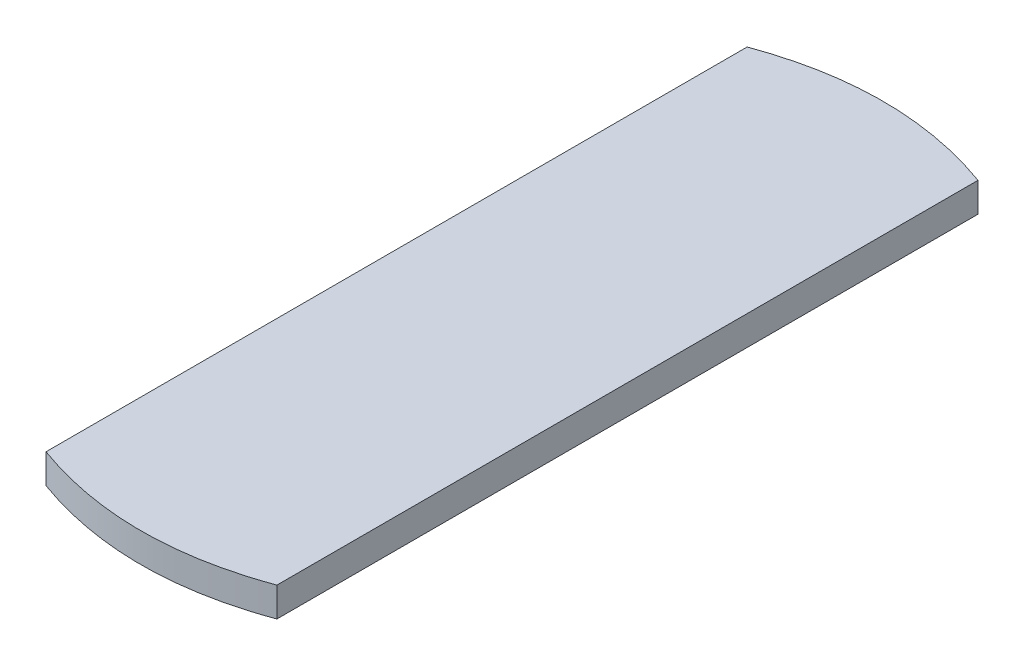
from build123d import *

# Parameters (mm, degrees)
SKETCH1_W           = 55
SKETCH1_H           = 167
BOSS_EXTRUDE1_DEPTH = 7


with BuildPart() as part:
    # Sketch1 → Boss-Extrude1 (new body)
    with BuildSketch(Plane(origin=(0, 0, 0), x_dir=(1, 0, 0), z_dir=(0, 1, 0))):
        with BuildLine():
            add(Edge.make_bspline(
                [(-27.5, 83.5), (-0.298519589, 93.5), (27.5, 83.5)],
                knots=[0, 0, 0, 1, 1, 1], degree=2))
            Line((27.5, 83.5), (-27.5, 83.5))
        make_face()
        Rectangle(SKETCH1_W, SKETCH1_H)
        with BuildLine():
            Line((-27.5, -83.5), (27.5, -83.5))
            add(Edge.make_bspline(
                [(-27.5, -83.5), (0.185844537, -93.5), (27.5, -83.5)],
                knots=[0, 0, 0, 1, 1, 1], degree=2))
        make_face()
    extrude(amount=BOSS_EXTRUDE1_DEPTH)


solid = part.part
